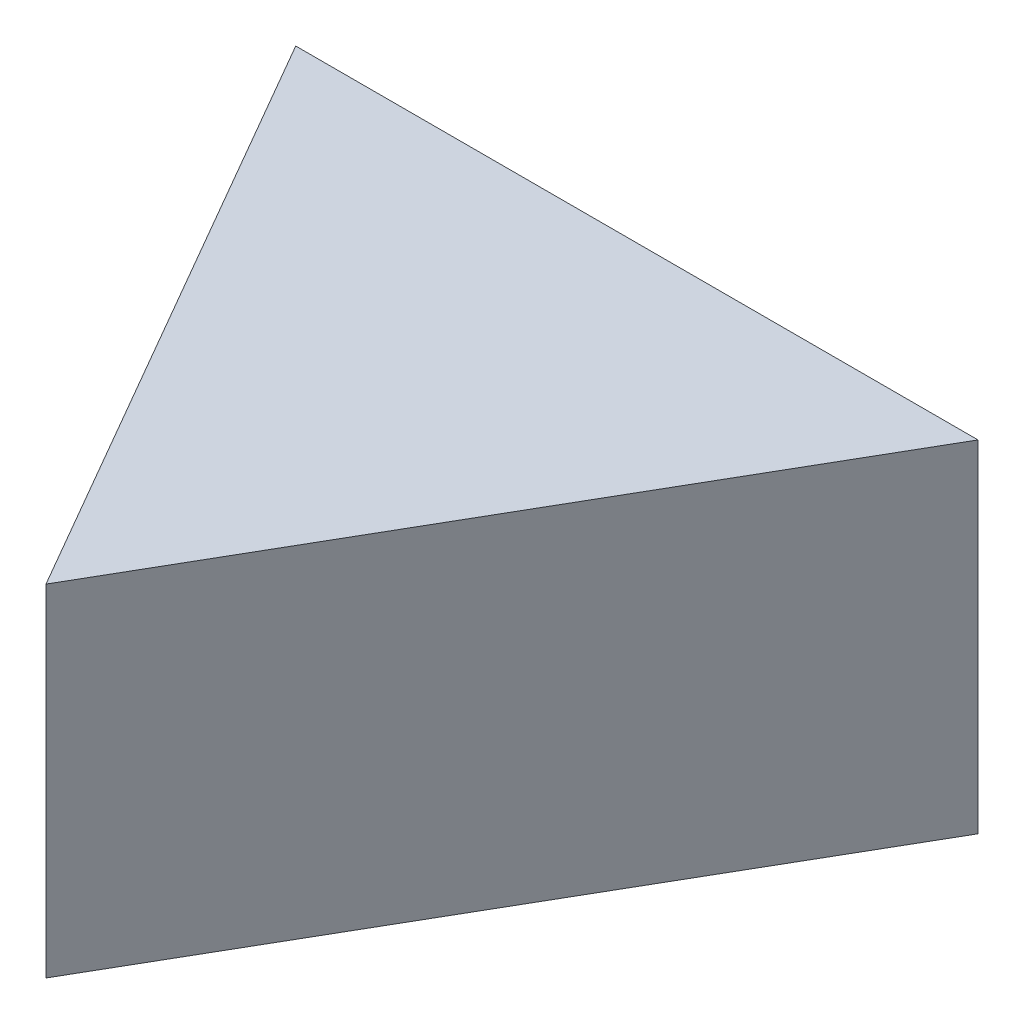
from build123d import *

# Parameters (mm, degrees)
BOSS_EXTRUDE1_DEPTH = 20


with BuildPart() as part:
    # Sketch1 → Boss-Extrude1 (new body)
    with BuildSketch(Plane(origin=(0, 0, 0), x_dir=(1, 0, 0), z_dir=(0, 1, 0))):
        Polygon((-20, 0), (20, 0), (0, -34.641016151), align=None)
    extrude(amount=BOSS_EXTRUDE1_DEPTH)


solid = part.part
